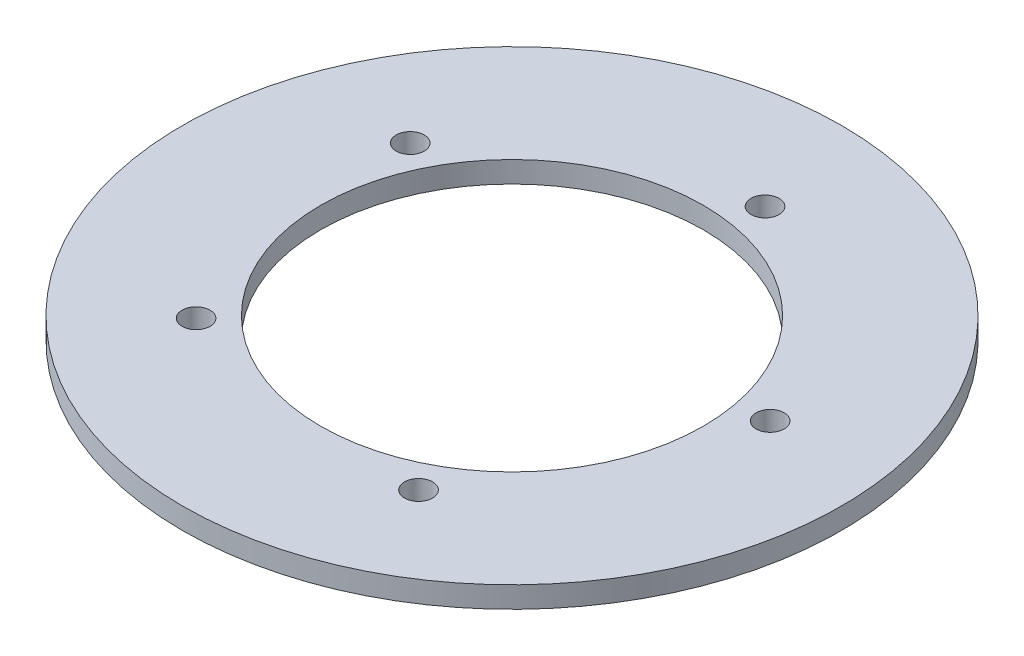
from build123d import *

# Parameters (mm, degrees)
SKETCH1_R            = 77.5
SKETCH1_R_2          = 45
BODY_DEPTH           = 5
M6_CLEARANCE_HOLE1_D = 6.6


with BuildPart() as part:
    # Sketch1 → Body (new body)
    with BuildSketch(Plane(origin=(0, 0, 0), x_dir=(1, 0, 0), z_dir=(0, 1, 0))):
        with Locations(Location((0, 0, 0), (0, 0, 270))):
            Circle(SKETCH1_R)
        with Locations(Location((0, 0, 0), (0, 0, 270))):
            Circle(SKETCH1_R_2, mode=Mode.SUBTRACT)
    extrude(amount=BODY_DEPTH)

    # M6 Clearance Hole1 (through all)
    with Locations(Plane(origin=(0, 5, 0), x_dir=(1, 0, 0), z_dir=(0, 1, 0))):
        with Locations((7.5, 52), (51.772566305, 8.935959835), (24.497205661, -46.4772731), (-36.632460577, -37.660494315), (-47.13731139, 23.20180758), (0, 0)):
            Hole(M6_CLEARANCE_HOLE1_D / 2)


solid = part.part
